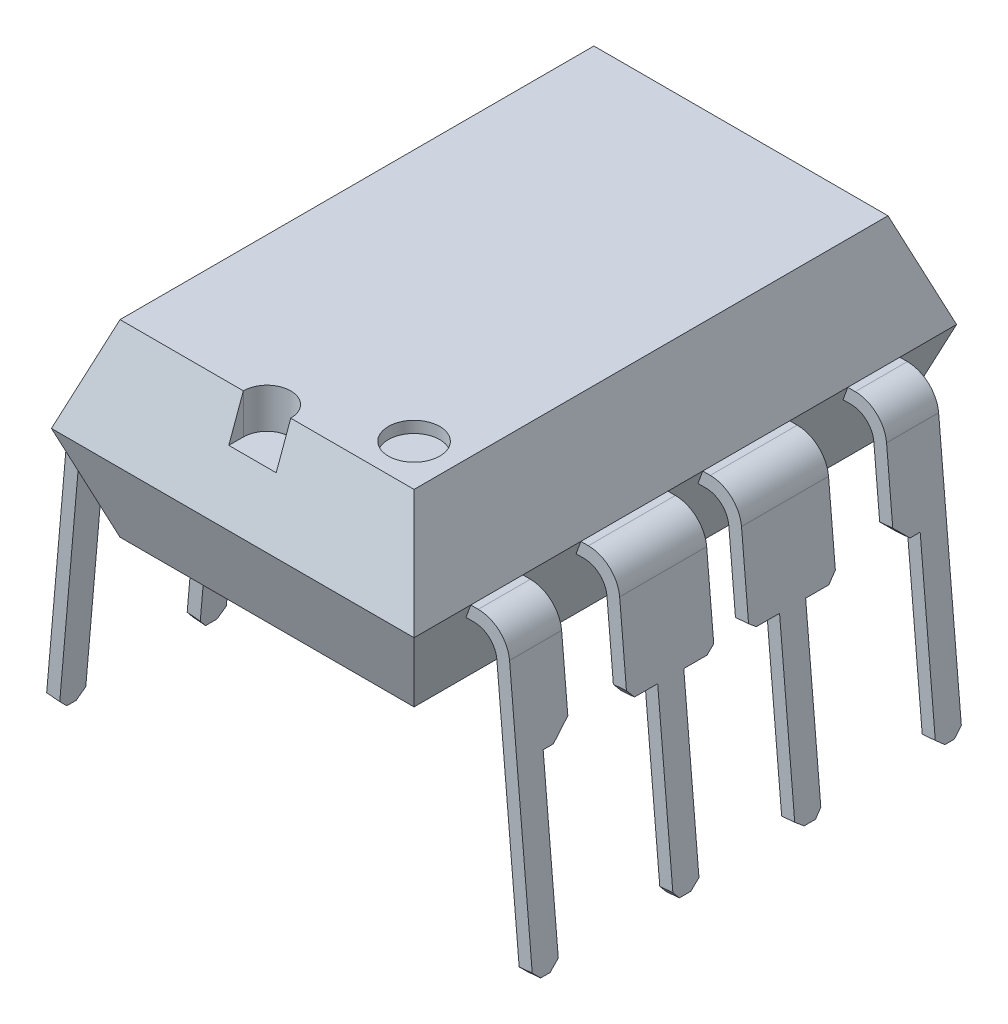
from build123d import *

# Parameters (mm, degrees)
BOSS_EXTRUDE1_DEPTH     = 9.5
CUT_EXTRUDE2_DEPTH      = 9.5
CUT_EXTRUDE2_DEPTH_BACK = 9.5
CUT_EXTRUDE3_DEPTH      = 0.7
SKETCH4_W               = 0.83
SKETCH4_H               = 0.7
CUT_EXTRUDE4_DEPTH      = 0.7
BOSS_EXTRUDE2_START     = -0.762
BOSS_EXTRUDE2_DEPTH     = 0.912
CUT_EXTRUDE5_DEPTH      = 10.15
SKETCH9_R               = 0.45
CUT_EXTRUDE7_DEPTH      = 0.2
BOSS_EXTRUDE3_DEPTH     = 0.762
CUT_EXTRUDE6_DEPTH      = 0.762
MIRROR2_START           = -0.762
MIRROR2_COPY_1_DEPTH    = 0.912
MIRROR2_COPY_2_DEPTH    = 10.15
MIRROR2_COPY_3_DEPTH    = 0.762
MIRROR2_COPY_4_DEPTH    = 0.762


with BuildPart() as part:
    # Sketch1 → Boss-Extrude1 (new body)
    with BuildSketch(Plane.XY):
        Polygon((-24.934327538, -0.557710036), (-25.534514454, 1.091289964), (-30.684140621, 1.091289964), (-31.284327538, -0.557710036), (-30.683412681, -2.208710036), (-25.535242395, -2.208710036), align=None)
    extrude(amount=-BOSS_EXTRUDE1_DEPTH)

    # Sketch2 → Cut-Extrude2 (cut, two sides: drawn at the far end of the back side and taken through both)
    with BuildSketch(Plane(origin=(-30.683898403, -0.0067685, 0), x_dir=(0, 0, 1), z_dir=(-0.9999999756704636, -0.00022058801540043594, 0)).offset(-CUT_EXTRUDE2_DEPTH_BACK)):
        Polygon((-0.616330332, -2.245563479), (0, -0.552209808), (0, -2.212209808), align=None)
        Polygon((-0.60064854, 1.098058491), (0, -0.552209808), (0, 1.098058491), align=None)
        Polygon((-9.5, -2.212209808), (-8.892247033, -2.221997362), (-9.5, -0.552209808), align=None)
        Polygon((-9.5, -0.552209808), (-9.5, 1.098058491), (-8.89935146, 1.098058491), align=None)
    extrude(amount=CUT_EXTRUDE2_DEPTH + CUT_EXTRUDE2_DEPTH_BACK, mode=Mode.SUBTRACT)

    # Sketch3 → Cut-Extrude3 (cut)
    with BuildSketch(Plane(origin=(0, 1.091289964, 0), x_dir=(1, 0, 0), z_dir=(0, 1, 0))):
        with BuildLine():
            Line((-28.524327536, 0.600475134), (-27.694327539, 0.600408495))
            ThreePointArc((-27.694327539, 0.600408495), (-28.109294218, 1.015441813), (-28.524327536, 0.600475134))
        make_face()
    extrude(amount=-CUT_EXTRUDE3_DEPTH, mode=Mode.SUBTRACT)

    # Sketch4 → Cut-Extrude4 (cut)
    with BuildSketch(Plane(origin=(4.8027e-05, 0, -0.598184984), x_dir=(-0.9999999967769609, 0, -8.028747138262029e-05), z_dir=(8.028747138262029e-05, 0, -0.9999999967769609))):
        with Locations((28.109375655, 0.741289964)):
            Rectangle(SKETCH4_W, SKETCH4_H)
    extrude(amount=-CUT_EXTRUDE4_DEPTH, mode=Mode.SUBTRACT)


with BuildPart() as boss_extrude2_tool:
    # Sketch5 → Boss-Extrude2 (new body)
    with BuildSketch(Plane.XY.offset(-1.143).offset(BOSS_EXTRUDE2_START)):
        with BuildLine():
            Line((-24.934327536, -0.557713614), (-24.80305479, -0.557713614))
            ThreePointArc((-24.80305479, -0.557713614), (-24.431480176, -0.702211079), (-24.255147706, -1.059777956))
            Line((-24.255147706, -1.059777956), (-23.8457982, -5.738664215))
            Line((-23.8457982, -5.738664215), (-24.074922981, -5.758710036))
            Line((-24.074922981, -5.758710036), (-24.477883405, -1.152851317))
            ThreePointArc((-24.477883405, -1.152851317), (-24.606125201, -0.892802679), (-24.876361284, -0.787713614))
            Line((-24.876361284, -0.787713614), (-25.018040872, -0.787713614))
            Line((-25.018040872, -0.787713614), (-24.934327536, -0.557713614))
        make_face()
    boss_extrude2 = extrude(amount=BOSS_EXTRUDE2_DEPTH)


with BuildPart() as part_1:
    add(part.part)


with BuildPart() as part_2:
    # Boss-Extrude2: joined with boss_extrude2_tool
    add(part_1.part.fuse(boss_extrude2_tool.part, tol=0.00001))

    # Sketch6 → Cut-Extrude5 (cut)
    with BuildSketch(Plane(origin=(-24.162916864, -2.113981303, 0), x_dir=(0, 0, -1), z_dir=(0.9961946980917458, 0.08715574274765556, 0))):
        Polygon((0.993, -3.502234692), (0.993, -3.638528611), (1.129293919, -3.638528611), align=None)
        Polygon((1.449, -3.502234692), (1.292810168, -3.638528611), (1.449, -3.638528611), align=None)
        Polygon((1.449, -3.502234692), (1.449, -3.638528611), (1.905, -3.638528611), (1.905, -0.186528611), (1.628, -0.463528611), (1.449, -0.463528611), align=None)
    cut_extrude5 = extrude(amount=-CUT_EXTRUDE5_DEPTH, mode=Mode.SUBTRACT)

    # Sketch9 → Cut-Extrude7 (cut)
    with BuildSketch(Plane(origin=(0, 1.091289964, 0), x_dir=(1, 0, 0), z_dir=(0, 1, 0))):
        with Locations(Location((-26.264514454, 1.330293701, 0), (0, 0, 180))):
            Circle(SKETCH9_R)
    extrude(amount=-CUT_EXTRUDE7_DEPTH, mode=Mode.SUBTRACT)

    # Sketch7 → Boss-Extrude3 (add, symmetric)
    with BuildSketch(Plane.XY.offset(-3.683)):
        with BuildLine():
            Line((-24.934327538, -0.557710036), (-24.803054792, -0.557710036))
            ThreePointArc((-24.803054792, -0.557710036), (-24.431480177, -0.7022075), (-24.255147708, -1.059774377))
            Line((-24.255147708, -1.059774377), (-23.845798202, -5.738660636))
            Line((-23.845798202, -5.738660636), (-24.074922983, -5.758706457))
            Line((-24.074922983, -5.758706457), (-24.477883406, -1.152847739))
            ThreePointArc((-24.477883406, -1.152847739), (-24.606125202, -0.892799101), (-24.876361286, -0.787710036))
            Line((-24.876361286, -0.787710036), (-25.018040873, -0.787710036))
            Line((-25.018040873, -0.787710036), (-24.934327538, -0.557710036))
        make_face()
    boss_extrude3 = extrude(amount=BOSS_EXTRUDE3_DEPTH, both=True)

    # Sketch8 → Cut-Extrude6 (cut)
    with BuildSketch(Plane(origin=(-24.162916555, -2.113981276, 0), x_dir=(0, 0, -1), z_dir=(0.9961946980917459, 0.08715574274765502, 0))):
        Polygon((2.921, -3.638525046), (3.4545, -3.638525046), (3.4545, -3.512139824), (3.4545, -0.463528611), (3.048, -0.463528611), (2.921, -0.309075706), align=None)
        Polygon((3.9115, -0.463528611), (3.9115, -3.512139824), (3.9115, -3.638525046), (4.445, -3.638525046), (4.445, -0.359101958), (4.318, -0.463528611), align=None)
        Polygon((3.4545, -3.512139824), (3.4545, -3.638525046), (3.558421148, -3.638525046), align=None)
        Polygon((3.9115, -3.512139824), (3.757794765, -3.638525046), (3.9115, -3.638525046), align=None)
    cut_extrude6 = extrude(amount=-CUT_EXTRUDE6_DEPTH, mode=Mode.SUBTRACT)

    # Mirror1: Boss-Extrude2, Cut-Extrude5, Boss-Extrude3, Cut-Extrude6 across plane
    add(boss_extrude2.mirror(Plane.XY.offset(-4.75)))
    add(cut_extrude5.mirror(Plane.XY.offset(-4.75)), mode=Mode.SUBTRACT)
    add(boss_extrude3.mirror(Plane.XY.offset(-4.75)))
    add(cut_extrude6.mirror(Plane.XY.offset(-4.75)), mode=Mode.SUBTRACT)

    # Mirror2: Boss-Extrude2, Cut-Extrude5, Boss-Extrude3, Cut-Extrude6 across plane
    add(boss_extrude2.mirror(Plane(origin=(-28.109327538, 0, 0), x_dir=(0, 0, 1), z_dir=(1, 0, 0))))
    add(cut_extrude5.mirror(Plane(origin=(-28.109327538, 0, 0), x_dir=(0, 0, 1), z_dir=(1, 0, 0))), mode=Mode.SUBTRACT)
    add(boss_extrude3.mirror(Plane(origin=(-28.109327538, 0, 0), x_dir=(0, 0, 1), z_dir=(1, 0, 0))))
    add(cut_extrude6.mirror(Plane(origin=(-28.109327538, 0, 0), x_dir=(0, 0, 1), z_dir=(1, 0, 0))), mode=Mode.SUBTRACT)


with BuildPart() as mirror2_copy_1_tool:
    # Mirror2 copy 1 sketch → Mirror2 copy 1 (new body)
    with BuildSketch(Plane(origin=(-56.218655076, 0, -8.357), x_dir=(-1, 0, 0), z_dir=(0, 0, -1)).offset(MIRROR2_START)):
        with BuildLine():
            Line((-24.934327536, -0.557713614), (-24.80305479, -0.557713614))
            ThreePointArc((-24.80305479, -0.557713614), (-24.431480176, -0.702211079), (-24.255147706, -1.059777956))
            Line((-24.255147706, -1.059777956), (-23.8457982, -5.738664215))
            Line((-23.8457982, -5.738664215), (-24.074922981, -5.758710036))
            Line((-24.074922981, -5.758710036), (-24.477883405, -1.152851317))
            ThreePointArc((-24.477883405, -1.152851317), (-24.606125201, -0.892802679), (-24.876361284, -0.787713614))
            Line((-24.876361284, -0.787713614), (-25.018040872, -0.787713614))
            Line((-25.018040872, -0.787713614), (-24.934327536, -0.557713614))
        make_face()
    extrude(amount=MIRROR2_COPY_1_DEPTH)


with BuildPart() as part_3:
    add(part_2.part)


with BuildPart() as part_4:
    # Mirror2 copy 1: joined with mirror2_copy_1_tool
    add(part_3.part.fuse(mirror2_copy_1_tool.part, tol=0.00001))

    # Mirror2 copy 2 sketch → Mirror2 copy 2 (cut)
    with BuildSketch(Plane(origin=(-32.055738211, -2.113981303, -9.5), x_dir=(0, 0, 1), z_dir=(-0.9961946980917458, 0.08715574274765556, 0))):
        Polygon((0.993, -3.502234692), (0.993, -3.638528611), (1.129293919, -3.638528611), align=None)
        Polygon((1.449, -3.502234692), (1.292810168, -3.638528611), (1.449, -3.638528611), align=None)
        Polygon((1.449, -3.502234692), (1.449, -3.638528611), (1.905, -3.638528611), (1.905, -0.186528611), (1.628, -0.463528611), (1.449, -0.463528611), align=None)
    extrude(amount=-MIRROR2_COPY_2_DEPTH, mode=Mode.SUBTRACT)

    # Mirror2 copy 3 sketch → Mirror2 copy 3 (add, symmetric)
    with BuildSketch(Plane(origin=(-56.218655076, 0, -5.817), x_dir=(-1, 0, 0), z_dir=(0, 0, -1))):
        with BuildLine():
            Line((-24.934327538, -0.557710036), (-24.803054792, -0.557710036))
            ThreePointArc((-24.803054792, -0.557710036), (-24.431480177, -0.7022075), (-24.255147708, -1.059774377))
            Line((-24.255147708, -1.059774377), (-23.845798202, -5.738660636))
            Line((-23.845798202, -5.738660636), (-24.074922983, -5.758706457))
            Line((-24.074922983, -5.758706457), (-24.477883406, -1.152847739))
            ThreePointArc((-24.477883406, -1.152847739), (-24.606125202, -0.892799101), (-24.876361286, -0.787710036))
            Line((-24.876361286, -0.787710036), (-25.018040873, -0.787710036))
            Line((-25.018040873, -0.787710036), (-24.934327538, -0.557710036))
        make_face()
    extrude(amount=MIRROR2_COPY_3_DEPTH, both=True)

    # Mirror2 copy 4 sketch → Mirror2 copy 4 (cut)
    with BuildSketch(Plane(origin=(-32.055738521, -2.113981276, -9.5), x_dir=(0, 0, 1), z_dir=(-0.9961946980917459, 0.08715574274765502, 0))):
        Polygon((2.921, -3.638525046), (3.4545, -3.638525046), (3.4545, -3.512139824), (3.4545, -0.463528611), (3.048, -0.463528611), (2.921, -0.309075706), align=None)
        Polygon((3.9115, -0.463528611), (3.9115, -3.512139824), (3.9115, -3.638525046), (4.445, -3.638525046), (4.445, -0.359101958), (4.318, -0.463528611), align=None)
        Polygon((3.4545, -3.512139824), (3.4545, -3.638525046), (3.558421148, -3.638525046), align=None)
        Polygon((3.9115, -3.512139824), (3.757794765, -3.638525046), (3.9115, -3.638525046), align=None)
    extrude(amount=-MIRROR2_COPY_4_DEPTH, mode=Mode.SUBTRACT)


solid = part_4.part
